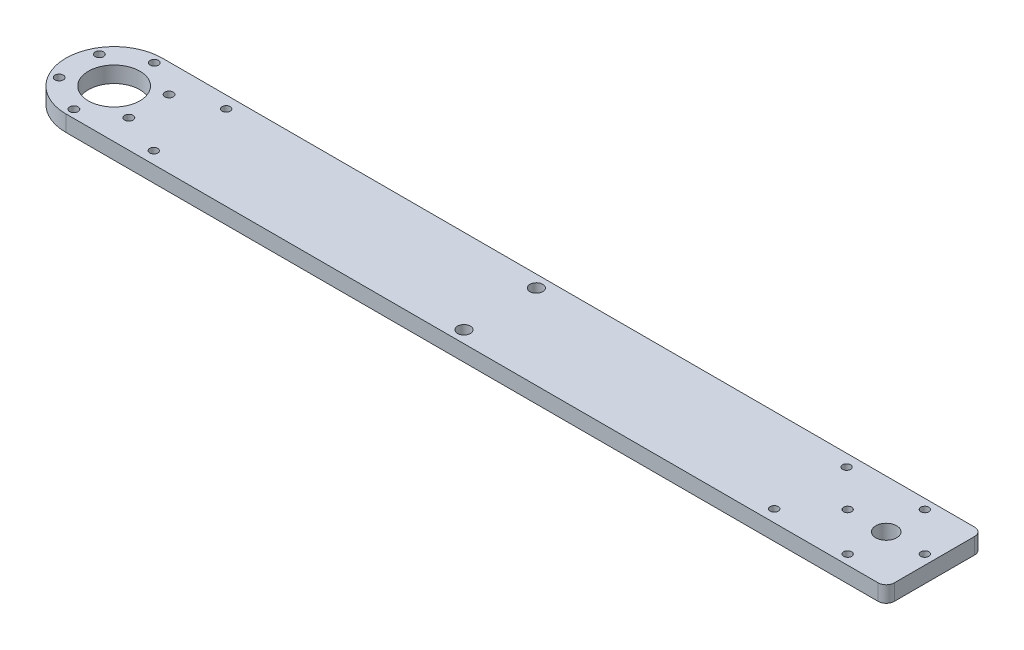
from build123d import *

# Parameters (mm, degrees)
SALIENTE_EXTRUIR1_DEPTH = 5
CROQUIS2_R              = 16
CORTAR_EXTRUIR1_DEPTH   = 10
CROQUIS4_R              = 2.6
CORTAR_EXTRUIR2_DEPTH   = 10
MATRIZC1_COUNT          = 6
REDONDEO1_R             = 10
CROQUIS5_R              = 16
CORTAR_EXTRUIR3_DEPTH   = 282.780056072
CORTAR_EXTRUIR4_DEPTH   = 282.780056072
REDONDEO2_R             = 5
CROQUIS7_R              = 2.5
CORTAR_EXTRUIR5_DEPTH   = 10
CROQUIS8_R              = 2.5
CORTAR_EXTRUIR6_DEPTH   = 282.780056072
SKETCH1_R               = 4
CUT_EXTRUDE1_DEPTH      = 10
SKETCH2_R               = 2.5
CUT_EXTRUDE2_DEPTH      = 282.780056072
CIRPATTERN1_COUNT       = 4
SKETCH3_R               = 16
SKETCH3_R_2             = 6.5
BOSS_EXTRUDE1_DEPTH     = 10


with BuildPart() as part:
    # Croquis1 → Saliente-Extruir1 (new, symmetric)
    with BuildSketch(Plane(origin=(0, 0, 0), x_dir=(1, 0, 0), z_dir=(0, 1, 0))):
        with BuildLine():
            Line((-250, 30), (250, 30))
            Line((250, 30), (280, 30))
            Line((280, 30), (280, 0))
            Line((280, 0), (280, -30))
            Line((280, -30), (250, -30))
            Line((250, -30), (-250, -30))
            ThreePointArc((-250, -30), (-280, 0), (-250, 30))
        make_face()
    extrude(amount=SALIENTE_EXTRUIR1_DEPTH, both=True)

    # Croquis2 → Cortar-Extruir1 (cut)
    with BuildSketch(Plane(origin=(0, 5, 0), x_dir=(1, 0, 0), z_dir=(0, 1, 0))):
        with Locations(Location((-250, 0, 0), (0, 0, 270))):
            Circle(CROQUIS2_R)
    extrude(amount=-CORTAR_EXTRUIR1_DEPTH, mode=Mode.SUBTRACT)

    # Croquis4 → Cortar-Extruir2 (cut)
    with BuildSketch(Plane(origin=(0, 5, 0), x_dir=(1, 0, 0), z_dir=(0, 1, 0))):
        with Locations(Location((-250, 25, 0), (0, 0, 270))):
            Circle(CROQUIS4_R)
    cortar_extruir2 = extrude(amount=-CORTAR_EXTRUIR2_DEPTH, mode=Mode.SUBTRACT)

    # MatrizC1: Cortar-Extruir2 ×6 about axis
    matrizc1_axis = Axis((-250, 0, 0), (0, 1, 0))
    for i in range(1, MATRIZC1_COUNT):
        add(cortar_extruir2.rotate(matrizc1_axis, i * 360 / MATRIZC1_COUNT), mode=Mode.SUBTRACT)

    # Redondeo1
    redondeo1_edges = [part.edges().sort_by_distance(p)[0] for p in [
        (280, 0, -30),
        (280, 0, 30),
    ]]
    fillet(redondeo1_edges, radius=REDONDEO1_R)

    # Croquis5 → Cortar-Extruir3 (cut, through all)
    with BuildSketch(Plane(origin=(0, 5, 0), x_dir=(1, 0, 0), z_dir=(0, 1, 0))):
        with Locations(Location((230, 0, 0), (0, 0, 270))):
            Circle(CROQUIS5_R)
    extrude(amount=-CORTAR_EXTRUIR3_DEPTH, mode=Mode.SUBTRACT)

    # Croquis6 → Cortar-Extruir4 (cut, through all)
    with BuildSketch(Plane(origin=(0, 5, 0), x_dir=(1, 0, 0), z_dir=(0, 1, 0))):
        with BuildLine():
            Line((260, 30), (260, -30))
            Line((260, -30), (270, -30))
            ThreePointArc((270, -30), (277.071067812, -27.071067812), (280, -20))
            Line((280, -20), (280, 20))
            ThreePointArc((280, 20), (277.071067812, 27.071067812), (270, 30))
            Line((270, 30), (260, 30))
        make_face()
    extrude(amount=-CORTAR_EXTRUIR4_DEPTH, mode=Mode.SUBTRACT)

    # Redondeo2
    redondeo2_edges = [part.edges().sort_by_distance(p)[0] for p in [
        (260, 0, 30),
        (260, 0, -30),
    ]]
    fillet(redondeo2_edges, radius=REDONDEO2_R)

    # Croquis7 → Cortar-Extruir5 (cut)
    with BuildSketch(Plane.XZ.offset(5)):
        with Locations(Location((182.85, -22.5, 0), (0, 0, 270))):
            Circle(CROQUIS7_R)
        with Locations(Location((182.85, 22.5, 0), (0, 0, 270))):
            Circle(CROQUIS7_R)
    extrude(amount=-CORTAR_EXTRUIR5_DEPTH, mode=Mode.SUBTRACT)

    # Croquis8 → Cortar-Extruir6 (cut, through all)
    with BuildSketch(Plane.XZ.offset(5)):
        with Locations(Location((-202.85, -22.5, 0), (0, 0, 270))):
            Circle(CROQUIS8_R)
        with Locations(Location((-202.85, 22.5, 0), (0, 0, 270))):
            Circle(CROQUIS8_R)
    extrude(amount=-CORTAR_EXTRUIR6_DEPTH, mode=Mode.SUBTRACT)

    # Sketch1 → Cut-Extrude1 (cut)
    with BuildSketch(Plane(origin=(0, -5, 0), x_dir=(-1, 0, 0), z_dir=(0, -1, 0))):
        with Locations(Location((10, -22.5, 0), (0, 0, 90))):
            Circle(SKETCH1_R)
    cut_extrude1 = extrude(amount=-CUT_EXTRUDE1_DEPTH, mode=Mode.SUBTRACT)

    # Mirror1: Cut-Extrude1 across plane
    add(cut_extrude1.mirror(Plane.XY), mode=Mode.SUBTRACT)

    # Sketch2 → Cut-Extrude2 (cut, through all)
    with BuildSketch(Plane(origin=(0, 5, 0), x_dir=(1, 0, 0), z_dir=(0, 1, 0))):
        with Locations(Location((230, 24, 0), (0, 0, 270))):
            Circle(SKETCH2_R)
    cut_extrude2 = extrude(amount=-CUT_EXTRUDE2_DEPTH, mode=Mode.SUBTRACT)

    # CirPattern1: Cut-Extrude2 ×4 about axis
    cirpattern1_axis = Axis((230, 0, 0), (0, 1, 0))
    for i in range(1, CIRPATTERN1_COUNT):
        add(cut_extrude2.rotate(cirpattern1_axis, i * 360 / CIRPATTERN1_COUNT), mode=Mode.SUBTRACT)

    # Sketch3 → Boss-Extrude1 (add)
    with BuildSketch(Plane(origin=(0, 5, 0), x_dir=(1, 0, 0), z_dir=(0, 1, 0))):
        with Locations((230, 0)):
            Circle(SKETCH3_R)
        with Locations(Location((230, 0, 0), (0, 0, 270))):
            Circle(SKETCH3_R_2, mode=Mode.SUBTRACT)
    extrude(amount=-BOSS_EXTRUDE1_DEPTH)


solid = part.part
